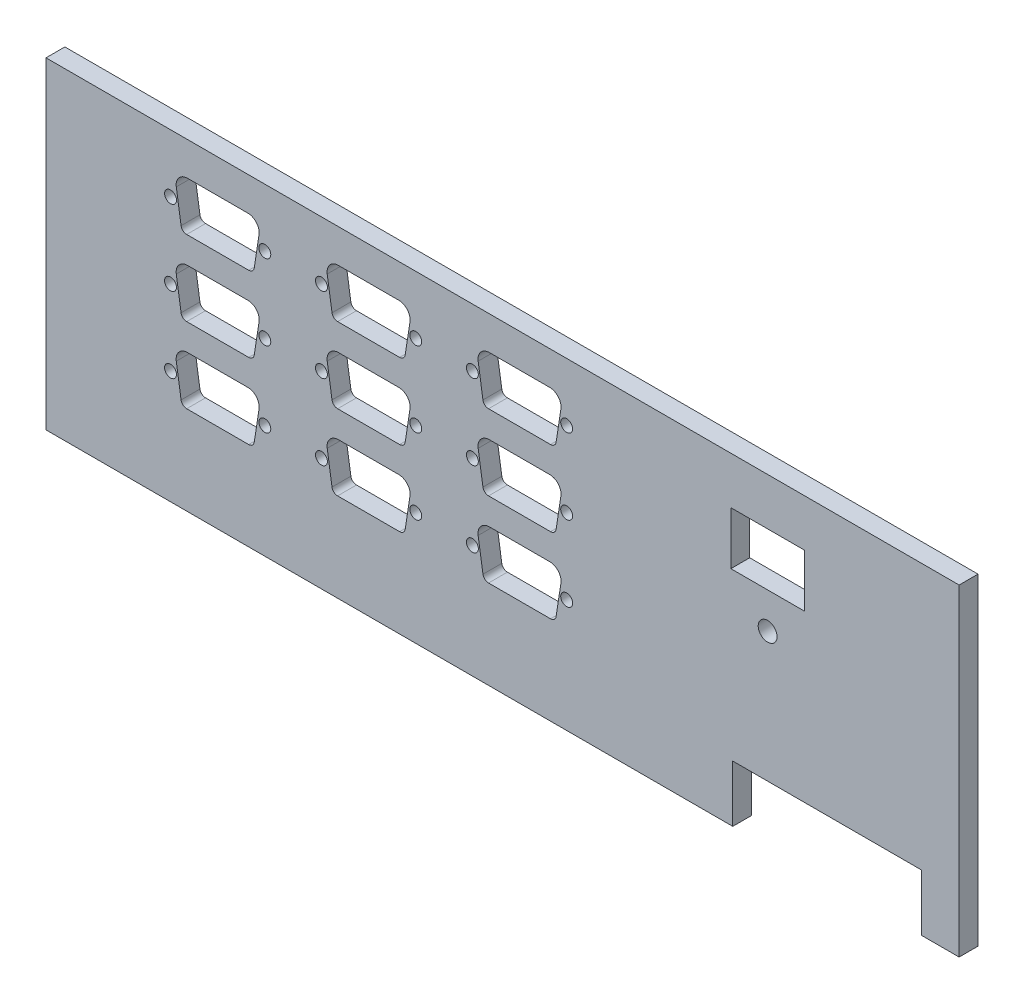
from build123d import *

# Parameters (mm, degrees)
SKETCH1_W           = 239
SKETCH1_H           = 85.4
BOSS_EXTRUDE1_DEPTH = 5
SKETCH2_R           = 1.58
CUT_EXTRUDE1_DEPTH  = 254.848695092
CUT_EXTRUDE2_DEPTH  = 254.848695092
SKETCH4_R           = 2.5
SKETCH4_W           = 50
SKETCH4_H           = 15
SKETCH4_W_2         = 19.5
SKETCH4_H_2         = 14
CUT_EXTRUDE3_DEPTH  = 254.848695092
SKETCH5_W           = 5
SKETCH5_H           = 85.4
BOSS_EXTRUDE2_DEPTH = 3


with BuildPart() as part:
    # Sketch1 → Boss-Extrude1 (new body)
    with BuildSketch(Plane.XY):
        with Locations((119.5, 42.7)):
            Rectangle(SKETCH1_W, SKETCH1_H)
    extrude(amount=BOSS_EXTRUDE1_DEPTH)

    # Sketch2 → Cut-Extrude1 (cut, through all)
    with BuildSketch(Plane.XY.offset(5)):
        with Locations((30, 30)):
            Circle(SKETCH2_R)
        with Locations((54.99, 30)):
            Circle(SKETCH2_R)
        with Locations((94.99, 30)):
            Circle(SKETCH2_R)
        with Locations((70, 30)):
            Circle(SKETCH2_R)
        with Locations((134.99, 30)):
            Circle(SKETCH2_R)
        with Locations((110, 30)):
            Circle(SKETCH2_R)
        with Locations((94.99, 50)):
            Circle(SKETCH2_R)
        with Locations((70, 50)):
            Circle(SKETCH2_R)
        with Locations((134.99, 50)):
            Circle(SKETCH2_R)
        with Locations((110, 50)):
            Circle(SKETCH2_R)
        with Locations((94.99, 70)):
            Circle(SKETCH2_R)
        with Locations((70, 70)):
            Circle(SKETCH2_R)
        with Locations((134.99, 70)):
            Circle(SKETCH2_R)
        with Locations((110, 70)):
            Circle(SKETCH2_R)
        with Locations((54.99, 50)):
            Circle(SKETCH2_R)
        with Locations((30, 50)):
            Circle(SKETCH2_R)
        with Locations((54.99, 70)):
            Circle(SKETCH2_R)
        with Locations((30, 70)):
            Circle(SKETCH2_R)
    extrude(amount=-CUT_EXTRUDE1_DEPTH, mode=Mode.SUBTRACT)

    # Sketch3 → Cut-Extrude2 (cut, through all)
    with BuildSketch(Plane.XY.offset(5)):
        with BuildLine():
            Line((31.5267187, 33.043828447), (32.799320889, 24.771914224))
            ThreePointArc((32.799320889, 24.771914224), (33.305182132, 23.861551788), (34.281878435, 23.5))
            Line((34.281878435, 23.5), (50.708121565, 23.5))
            ThreePointArc((50.708121565, 23.5), (51.684817868, 23.861551788), (52.190679111, 24.771914224))
            Line((52.190679111, 24.771914224), (53.4632813, 33.043828447))
            ThreePointArc((53.4632813, 33.043828447), (52.775062631, 35.453392605), (50.498166207, 36.5))
            Line((50.498166207, 36.5), (34.491833793, 36.5))
            ThreePointArc((34.491833793, 36.5), (32.214937369, 35.453392605), (31.5267187, 33.043828447))
        make_face()
        with BuildLine():
            Line((71.5267187, 33.043828447), (72.799320889, 24.771914224))
            ThreePointArc((72.799320889, 24.771914224), (73.305182132, 23.861551788), (74.281878435, 23.5))
            Line((74.281878435, 23.5), (90.708121565, 23.5))
            ThreePointArc((90.708121565, 23.5), (91.684817868, 23.861551788), (92.190679111, 24.771914224))
            Line((92.190679111, 24.771914224), (93.4632813, 33.043828447))
            ThreePointArc((93.4632813, 33.043828447), (92.775062631, 35.453392605), (90.498166207, 36.5))
            Line((90.498166207, 36.5), (74.491833793, 36.5))
            ThreePointArc((74.491833793, 36.5), (72.214937369, 35.453392605), (71.5267187, 33.043828447))
        make_face()
        with BuildLine():
            Line((111.5267187, 33.043828447), (112.799320889, 24.771914224))
            ThreePointArc((112.799320889, 24.771914224), (113.305182132, 23.861551788), (114.281878435, 23.5))
            Line((114.281878435, 23.5), (130.708121565, 23.5))
            ThreePointArc((130.708121565, 23.5), (131.684817868, 23.861551788), (132.190679111, 24.771914224))
            Line((132.190679111, 24.771914224), (133.4632813, 33.043828447))
            ThreePointArc((133.4632813, 33.043828447), (132.775062631, 35.453392605), (130.498166207, 36.5))
            Line((130.498166207, 36.5), (114.491833793, 36.5))
            ThreePointArc((114.491833793, 36.5), (112.214937369, 35.453392605), (111.5267187, 33.043828447))
        make_face()
        with BuildLine():
            Line((71.5267187, 53.043828447), (72.799320889, 44.771914224))
            ThreePointArc((72.799320889, 44.771914224), (73.305182132, 43.861551788), (74.281878435, 43.5))
            Line((74.281878435, 43.5), (90.708121565, 43.5))
            ThreePointArc((90.708121565, 43.5), (91.684817868, 43.861551788), (92.190679111, 44.771914224))
            Line((92.190679111, 44.771914224), (93.4632813, 53.043828447))
            ThreePointArc((93.4632813, 53.043828447), (92.775062631, 55.453392605), (90.498166207, 56.5))
            Line((90.498166207, 56.5), (74.491833793, 56.5))
            ThreePointArc((74.491833793, 56.5), (72.214937369, 55.453392605), (71.5267187, 53.043828447))
        make_face()
        with BuildLine():
            Line((111.5267187, 53.043828447), (112.799320889, 44.771914224))
            ThreePointArc((112.799320889, 44.771914224), (113.305182132, 43.861551788), (114.281878435, 43.5))
            Line((114.281878435, 43.5), (130.708121565, 43.5))
            ThreePointArc((130.708121565, 43.5), (131.684817868, 43.861551788), (132.190679111, 44.771914224))
            Line((132.190679111, 44.771914224), (133.4632813, 53.043828447))
            ThreePointArc((133.4632813, 53.043828447), (132.775062631, 55.453392605), (130.498166207, 56.5))
            Line((130.498166207, 56.5), (114.491833793, 56.5))
            ThreePointArc((114.491833793, 56.5), (112.214937369, 55.453392605), (111.5267187, 53.043828447))
        make_face()
        with BuildLine():
            Line((71.5267187, 73.043828447), (72.799320889, 64.771914224))
            ThreePointArc((72.799320889, 64.771914224), (73.305182132, 63.861551788), (74.281878435, 63.5))
            Line((74.281878435, 63.5), (90.708121565, 63.5))
            ThreePointArc((90.708121565, 63.5), (91.684817868, 63.861551788), (92.190679111, 64.771914224))
            Line((92.190679111, 64.771914224), (93.4632813, 73.043828447))
            ThreePointArc((93.4632813, 73.043828447), (92.775062631, 75.453392605), (90.498166207, 76.5))
            Line((90.498166207, 76.5), (74.491833793, 76.5))
            ThreePointArc((74.491833793, 76.5), (72.214937369, 75.453392605), (71.5267187, 73.043828447))
        make_face()
        with BuildLine():
            Line((111.5267187, 73.043828447), (112.799320889, 64.771914224))
            ThreePointArc((112.799320889, 64.771914224), (113.305182132, 63.861551788), (114.281878435, 63.5))
            Line((114.281878435, 63.5), (130.708121565, 63.5))
            ThreePointArc((130.708121565, 63.5), (131.684817868, 63.861551788), (132.190679111, 64.771914224))
            Line((132.190679111, 64.771914224), (133.4632813, 73.043828447))
            ThreePointArc((133.4632813, 73.043828447), (132.775062631, 75.453392605), (130.498166207, 76.5))
            Line((130.498166207, 76.5), (114.491833793, 76.5))
            ThreePointArc((114.491833793, 76.5), (112.214937369, 75.453392605), (111.5267187, 73.043828447))
        make_face()
        with BuildLine():
            Line((31.5267187, 53.043828447), (32.799320889, 44.771914224))
            ThreePointArc((32.799320889, 44.771914224), (33.305182132, 43.861551788), (34.281878435, 43.5))
            Line((34.281878435, 43.5), (50.708121565, 43.5))
            ThreePointArc((50.708121565, 43.5), (51.684817868, 43.861551788), (52.190679111, 44.771914224))
            Line((52.190679111, 44.771914224), (53.4632813, 53.043828447))
            ThreePointArc((53.4632813, 53.043828447), (52.775062631, 55.453392605), (50.498166207, 56.5))
            Line((50.498166207, 56.5), (34.491833793, 56.5))
            ThreePointArc((34.491833793, 56.5), (32.214937369, 55.453392605), (31.5267187, 53.043828447))
        make_face()
        with BuildLine():
            Line((31.5267187, 73.043828447), (32.799320889, 64.771914224))
            ThreePointArc((32.799320889, 64.771914224), (33.305182132, 63.861551788), (34.281878435, 63.5))
            Line((34.281878435, 63.5), (50.708121565, 63.5))
            ThreePointArc((50.708121565, 63.5), (51.684817868, 63.861551788), (52.190679111, 64.771914224))
            Line((52.190679111, 64.771914224), (53.4632813, 73.043828447))
            ThreePointArc((53.4632813, 73.043828447), (52.775062631, 75.453392605), (50.498166207, 76.5))
            Line((50.498166207, 76.5), (34.491833793, 76.5))
            ThreePointArc((34.491833793, 76.5), (32.214937369, 75.453392605), (31.5267187, 73.043828447))
        make_face()
    extrude(amount=-CUT_EXTRUDE2_DEPTH, mode=Mode.SUBTRACT)

    # Sketch4 → Cut-Extrude3 (cut, through all)
    with BuildSketch(Plane.XY.offset(5)):
        with Locations((188.25, 49.4)):
            Circle(SKETCH4_R)
        with Locations((204, 7.5)):
            Rectangle(SKETCH4_W, SKETCH4_H)
        with Locations((188.25, 65.9)):
            Rectangle(SKETCH4_W_2, SKETCH4_H_2)
    extrude(amount=-CUT_EXTRUDE3_DEPTH, mode=Mode.SUBTRACT)

    # Sketch5 → Boss-Extrude2 (add)
    with BuildSketch(Plane.ZY):
        with Locations((2.5, 42.7)):
            Rectangle(SKETCH5_W, SKETCH5_H)
    extrude(amount=BOSS_EXTRUDE2_DEPTH)


solid = part.part
